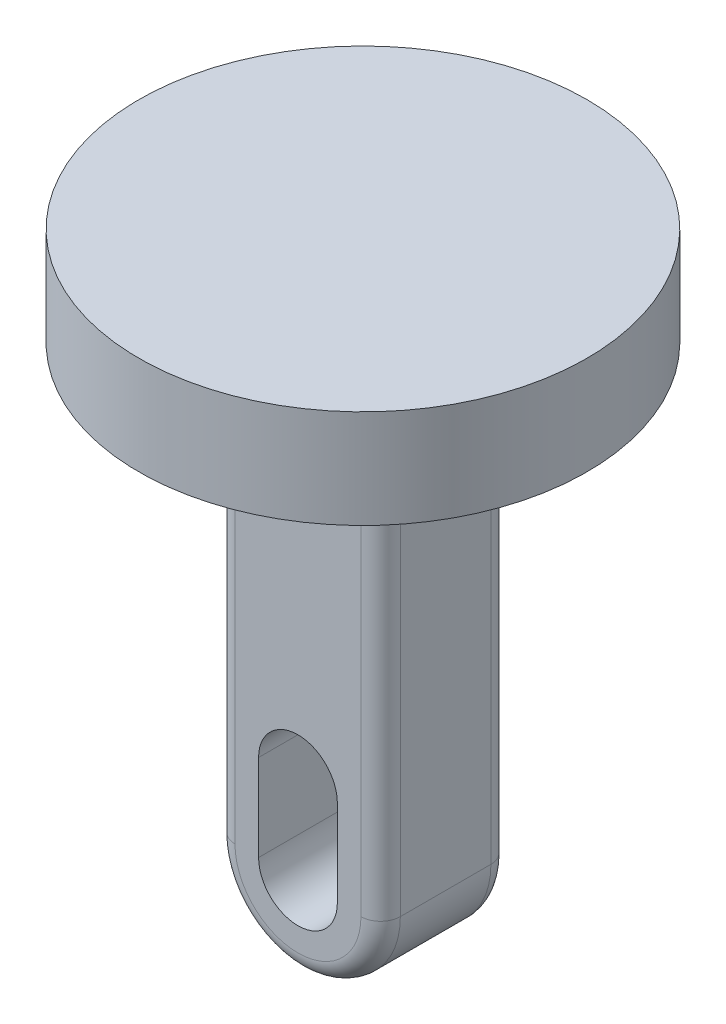
from build123d import *

# Parameters (mm, degrees)
BOSS_EXTRUDE1_DEPTH = 1.65
FILLET1_R           = 0.5


with BuildPart() as part:
    # Sketch1 → Boss-Extrude1 (new, symmetric)
    with BuildSketch(Plane.XY):
        with BuildLine():
            Line((2.1, 0), (2.1, 9.7))
            Line((2.1, 9.7), (-2.1, 9.7))
            Line((-2.1, 9.7), (-2.1, 0))
            ThreePointArc((-2.1, 0), (0, -2.1), (2.1, 0))
        make_face()
        with BuildLine():
            Line((1, 0), (1, 2.2))
            ThreePointArc((1, 2.2), (0, 3.2), (-1, 2.2))
            Line((-1, 2.2), (-1, 0))
            ThreePointArc((-1, 0), (0, -1), (1, 0))
        make_face(mode=Mode.SUBTRACT)
    extrude(amount=BOSS_EXTRUDE1_DEPTH, both=True)

    # Sketch2 → Revolve1 (revolve)
    with BuildSketch(Plane.XY, mode=Mode.PRIVATE) as revolve1_sk:
        Polygon((0, 13.5), (5.69, 13.5), (5.69, 11), (1.62, 11), (1.62, 9.7), (0, 9.7), align=None)
    revolve(revolve1_sk.sketch.rotate(Axis((0, 9.7, 0), (0, 1, 0)), 90), axis=Axis((0, 9.7, 0), (0, 1, 0)))

    # Fillet1
    fillet1_edges = [part.edges().sort_by_distance(p)[0] for p in [
        (2.1, 4.85, 1.65),
        (-2.1, 4.85, 1.65),
        (2.1, 4.85, -1.65),
        (0, -2.1, -1.65),
        (-2.1, 4.85, -1.65),
        (0, -2.1, 1.65),
    ]]
    fillet(fillet1_edges, radius=FILLET1_R)


solid = part.part
